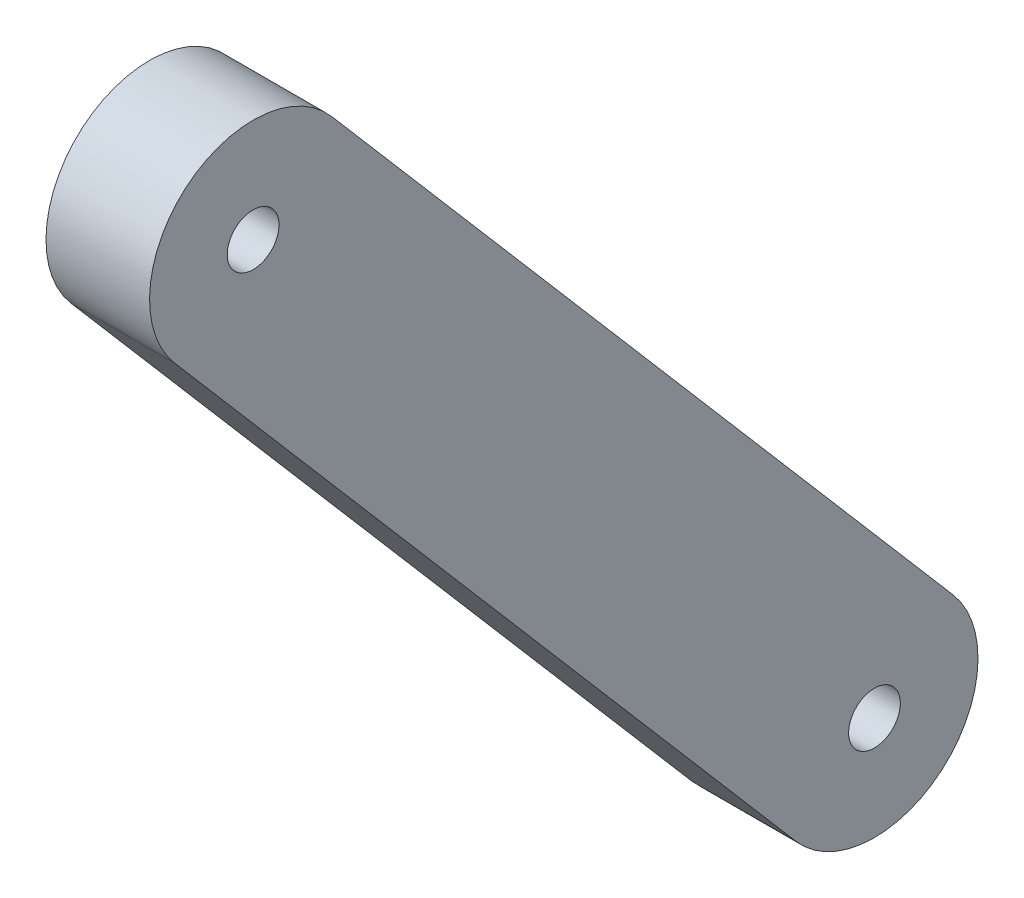
from build123d import *

# Parameters (mm, degrees)
SKETCH1_R           = 12.5
BOSS_EXTRUDE1_DEPTH = 50


with BuildPart() as part:
    # Sketch1 → Boss-Extrude1 (new body)
    with BuildSketch(Plane(origin=(0, 0, 0), x_dir=(0, 0, -1), z_dir=(1, 0, 0))):
        with BuildLine():
            Line((-37.962830118, -32.539568673), (-337.962830118, 317.460431327))
            ThreePointArc((-337.962830118, 317.460431327), (-332.539568673, 387.962830118), (-262.037169882, 382.539568673))
            Line((-262.037169882, 382.539568673), (37.962830118, 32.539568673))
            ThreePointArc((37.962830118, 32.539568673), (32.539568673, -37.962830118), (-37.962830118, -32.539568673))
        make_face()
        with Locations((-300, 350)):
            Circle(SKETCH1_R, mode=Mode.SUBTRACT)
        Circle(SKETCH1_R, mode=Mode.SUBTRACT)
    extrude(amount=BOSS_EXTRUDE1_DEPTH)


solid = part.part
